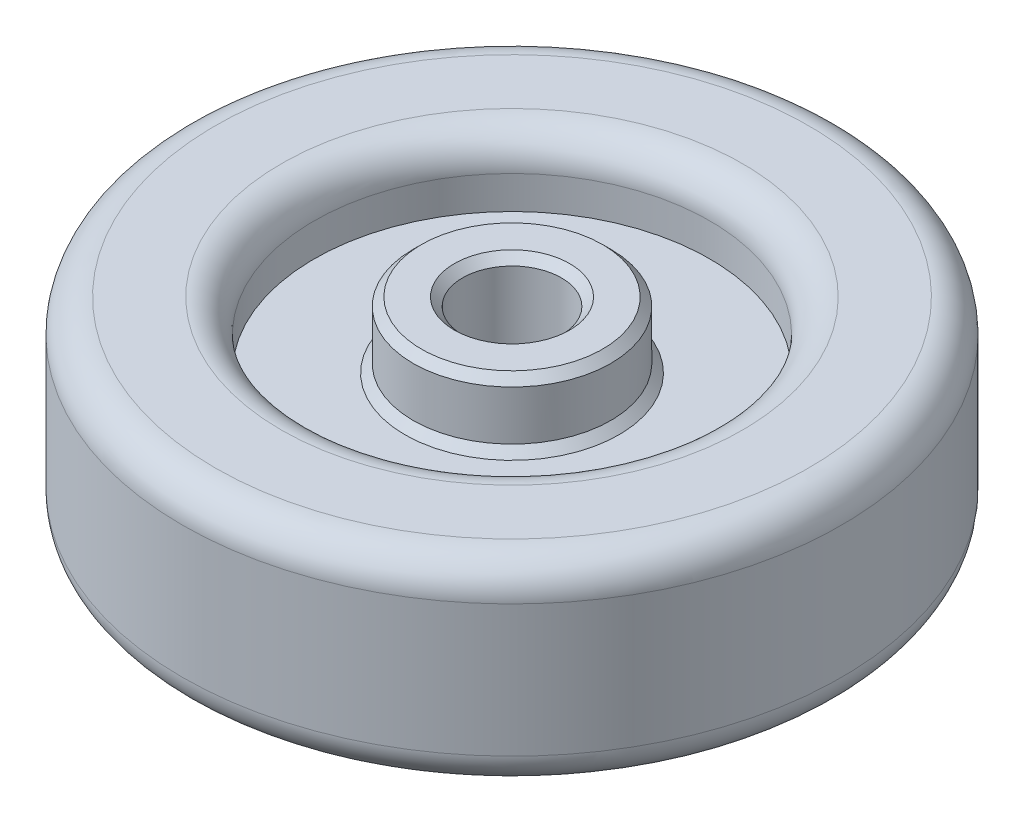
from build123d import *

# Parameters (mm, degrees)
SKETCH1_R               = 15.875
BOSS_EXTRUDE1_DEPTH     = 9.525
SKETCH2_R               = 9.525
SKETCH2_R_2             = 4.7625
CUT_EXTRUDE1_DEPTH      = 3.175
CUT_EXTRUDE2_DEPTH      = 25.387637749
CUT_EXTRUDE2_DEPTH_BACK = 25.387637749
SKETCH3_R               = 2.38125
FILLET2_R               = 1.5875
CHAMFER2_SIZE           = 0.396875


with BuildPart() as part:
    # Sketch1 → Boss-Extrude1 (new body)
    with BuildSketch(Plane(origin=(0, 0, 0), x_dir=(1, 0, 0), z_dir=(0, 1, 0))):
        with Locations(Location((0, 0, 0), (0, 0, 90))):
            Circle(SKETCH1_R)
    extrude(amount=BOSS_EXTRUDE1_DEPTH)

    # Sketch2 → Cut-Extrude1 (cut)
    with BuildSketch(Plane(origin=(0, 9.525, 0), x_dir=(1, 0, 0), z_dir=(0, 1, 0))):
        with Locations(Location((0, 0, 0), (0, 0, 270))):
            Circle(SKETCH2_R)
        with Locations(Location((0, 0, 0), (0, 0, 270))):
            Circle(SKETCH2_R_2, mode=Mode.SUBTRACT)
    extrude(amount=-CUT_EXTRUDE1_DEPTH, mode=Mode.SUBTRACT)

    # Sketch3 → Cut-Extrude2 (cut, two sides: drawn at the far end of the back side and taken through both)
    with BuildSketch(Plane(origin=(0, 9.525, 0), x_dir=(1, 0, 0), z_dir=(0, 1, 0)).offset(-CUT_EXTRUDE2_DEPTH_BACK)):
        with Locations(Location((0, 0, 0), (0, 0, 270))):
            Circle(SKETCH3_R)
    extrude(amount=CUT_EXTRUDE2_DEPTH + CUT_EXTRUDE2_DEPTH_BACK, mode=Mode.SUBTRACT)

    # Fillet2
    fillet2_edges = [part.edges().sort_by_distance(p)[0] for p in [
        (0, 0, 15.875),
        (0, 9.525, 15.875),
        (0, 9.525, -9.525),
    ]]
    fillet(fillet2_edges, radius=FILLET2_R)

    # Chamfer2
    chamfer2_edges = [part.edges().sort_by_distance(p)[0] for p in [
        (0, 9.525, -2.38125),
        (0, 0, -2.38125),
        (0, 6.35, -4.7625),
        (0, 9.525, -4.7625),
    ]]
    chamfer(chamfer2_edges, length=CHAMFER2_SIZE)


solid = part.part
